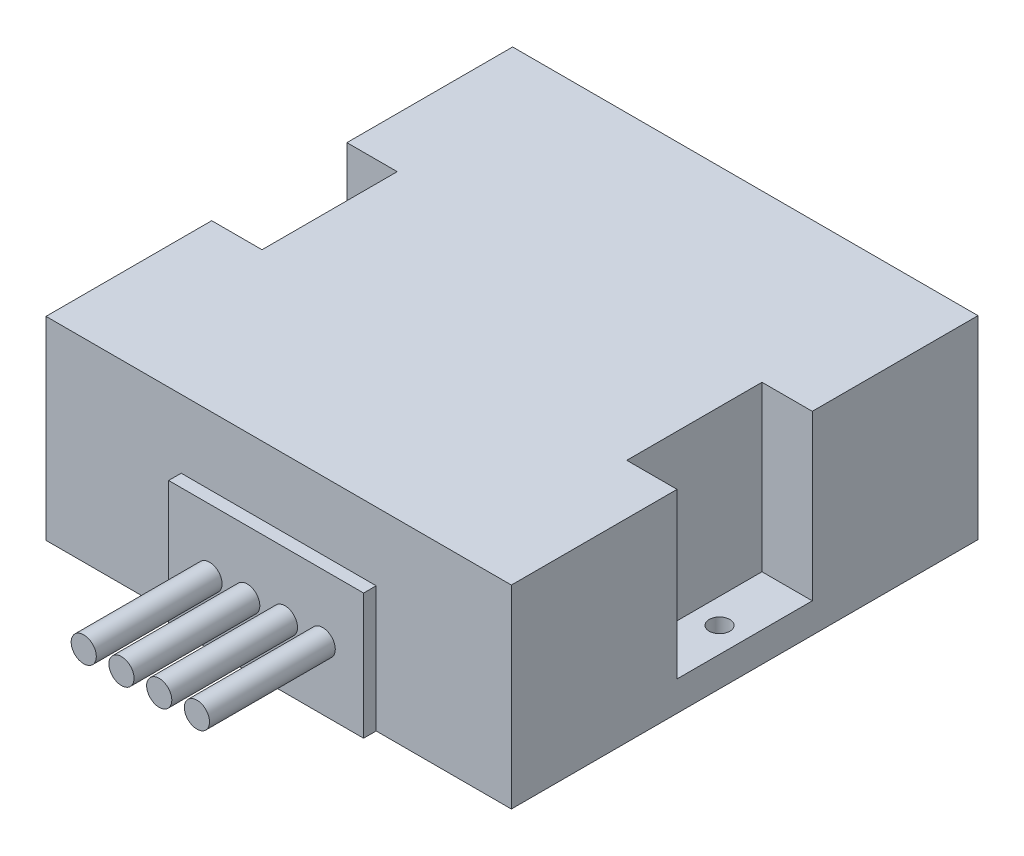
from build123d import *

# Parameters (mm, degrees)
SKETCH1_W                    = 74
SKETCH1_H                    = 74.2
BOSS_EXTRUDE1_DEPTH          = 15.425
SKETCH3_W                    = 8
SKETCH3_H                    = 21.5
CUT_EXTRUDE1_DEPTH           = 26.1
F_30_0_1285_DIAMETER_HOLE1_D = 3.2639
SKETCH6_W                    = 31
SKETCH6_H                    = 20
BOSS_EXTRUDE2_DEPTH          = 2
SKETCH7_R                    = 2
BOSS_EXTRUDE3_DEPTH          = 20


with BuildPart() as part:
    # Sketch1 → Boss-Extrude1 (new, symmetric)
    with BuildSketch(Plane(origin=(0, 0, 0), x_dir=(1, 0, 0), z_dir=(0, 1, 0))):
        Rectangle(SKETCH1_W, SKETCH1_H)
    extrude(amount=BOSS_EXTRUDE1_DEPTH, both=True)

    # Sketch3 → Cut-Extrude1 (cut)
    with BuildSketch(Plane(origin=(0, 15.425, 0), x_dir=(1, 0, 0), z_dir=(0, 1, 0))):
        with Locations((-33, 0)):
            Rectangle(SKETCH3_W, SKETCH3_H)
    cut_extrude1 = extrude(amount=-CUT_EXTRUDE1_DEPTH, mode=Mode.SUBTRACT)

    # #30 (0.1285) Diameter Hole1 (through all)
    with Locations(Plane(origin=(0, -10.675, 0), x_dir=(1, 0, 0), z_dir=(0, 1, 0))):
        with Locations((-33, 0)):
            f_30_0_1285_diameter_hole1 = Hole(F_30_0_1285_DIAMETER_HOLE1_D / 2)

    # Sketch6 → Boss-Extrude2 (add)
    with BuildSketch(Plane.XY.offset(37.1)):
        with Locations((0, -5.425)):
            Rectangle(SKETCH6_W, SKETCH6_H)
    extrude(amount=BOSS_EXTRUDE2_DEPTH)

    # Sketch7 → Boss-Extrude3 (add)
    with BuildSketch(Plane.XY.offset(39.1)):
        with Locations((-9, -5.425)):
            Circle(SKETCH7_R)
        with Locations((-3, -5.425)):
            Circle(SKETCH7_R)
    boss_extrude3 = extrude(amount=BOSS_EXTRUDE3_DEPTH)

    # Mirror1: Cut-Extrude1, #30 (0.1285) Diameter Hole1, Boss-Extrude3 across plane
    add(cut_extrude1.mirror(Plane(origin=(0, 0, 0), x_dir=(0, 0, 1), z_dir=(1, 0, 0))), mode=Mode.SUBTRACT)
    add(f_30_0_1285_diameter_hole1.mirror(Plane(origin=(0, 0, 0), x_dir=(0, 0, 1), z_dir=(1, 0, 0))), mode=Mode.SUBTRACT)
    add(boss_extrude3.mirror(Plane(origin=(0, 0, 0), x_dir=(0, 0, 1), z_dir=(1, 0, 0))))


solid = part.part
